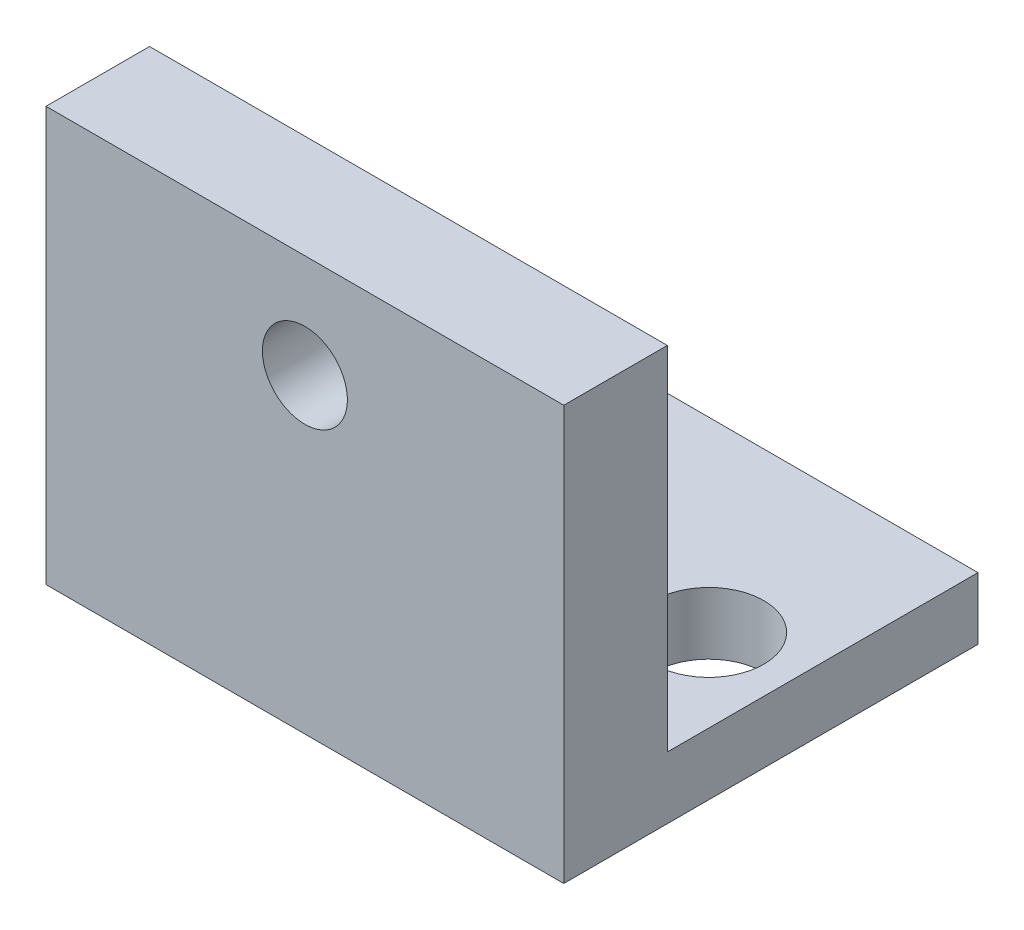
from build123d import *

# Parameters (mm, degrees)
BOSS_EXTRUDE1_DEPTH = 31.75
SKETCH3_R           = 2.6035
CUT_EXTRUDE1_DEPTH  = 45.901280605
SKETCH4_R           = 3.3782
CUT_EXTRUDE2_DEPTH  = 45.901280605
SKETCH5_W           = 31.75
SKETCH5_H           = 19.05
CUT_EXTRUDE3_DEPTH  = 2.54


with BuildPart() as part:
    # Sketch2 → Boss-Extrude1 (new body)
    with BuildSketch(Plane(origin=(0, 0, 0), x_dir=(0, 0, -1), z_dir=(1, 0, 0))):
        Polygon((0, 0), (25.4, 0), (25.4, 6.35), (6.35, 6.35), (6.35, 25.4), (0, 25.4), align=None)
    extrude(amount=BOSS_EXTRUDE1_DEPTH)

    # Sketch3 → Cut-Extrude1 (cut, through all)
    with BuildSketch(Plane(origin=(0, 0, -6.35), x_dir=(-1, 0, 0), z_dir=(0, 0, -1))):
        with Locations((-15.875, 19.05)):
            Circle(SKETCH3_R)
    extrude(amount=-CUT_EXTRUDE1_DEPTH, mode=Mode.SUBTRACT)

    # Sketch4 → Cut-Extrude2 (cut, through all)
    with BuildSketch(Plane(origin=(0, 6.35, 0), x_dir=(1, 0, 0), z_dir=(0, 1, 0))):
        with Locations(Location((5.08, 17.78, 0), (0, 0, 270))):
            Circle(SKETCH4_R)
        with Locations(Location((26.67, 13.97, 0), (0, 0, 270))):
            Circle(SKETCH4_R)
    extrude(amount=-CUT_EXTRUDE2_DEPTH, mode=Mode.SUBTRACT)

    # Sketch5 → Cut-Extrude3 (cut)
    with BuildSketch(Plane(origin=(0, 6.35, 0), x_dir=(1, 0, 0), z_dir=(0, 1, 0))):
        with Locations((15.875, 15.875)):
            Rectangle(SKETCH5_W, SKETCH5_H)
    extrude(amount=-CUT_EXTRUDE3_DEPTH, mode=Mode.SUBTRACT)


solid = part.part
